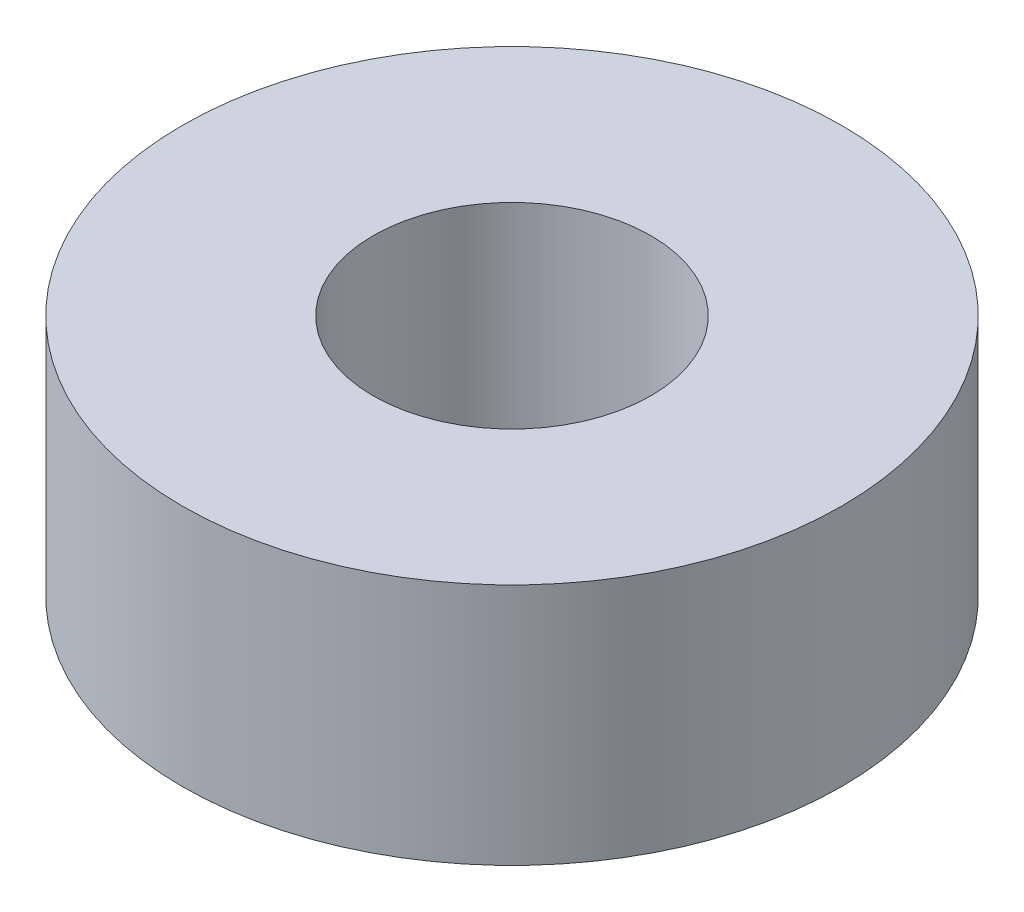
from build123d import *

# Parameters (mm, degrees)
SKETCH1_R           = 9.5
SKETCH1_R_2         = 4
BOSS_EXTRUDE1_DEPTH = 7


with BuildPart() as part:
    # Sketch1 → Boss-Extrude1 (new body)
    with BuildSketch(Plane(origin=(0, 0, 0), x_dir=(1, 0, 0), z_dir=(0, 1, 0))):
        with Locations(Location((0, 0, 0), (0, 0, 270))):
            Circle(SKETCH1_R)
        with Locations(Location((0, 0, 0), (0, 0, 270))):
            Circle(SKETCH1_R_2, mode=Mode.SUBTRACT)
    extrude(amount=BOSS_EXTRUDE1_DEPTH)


solid = part.part
